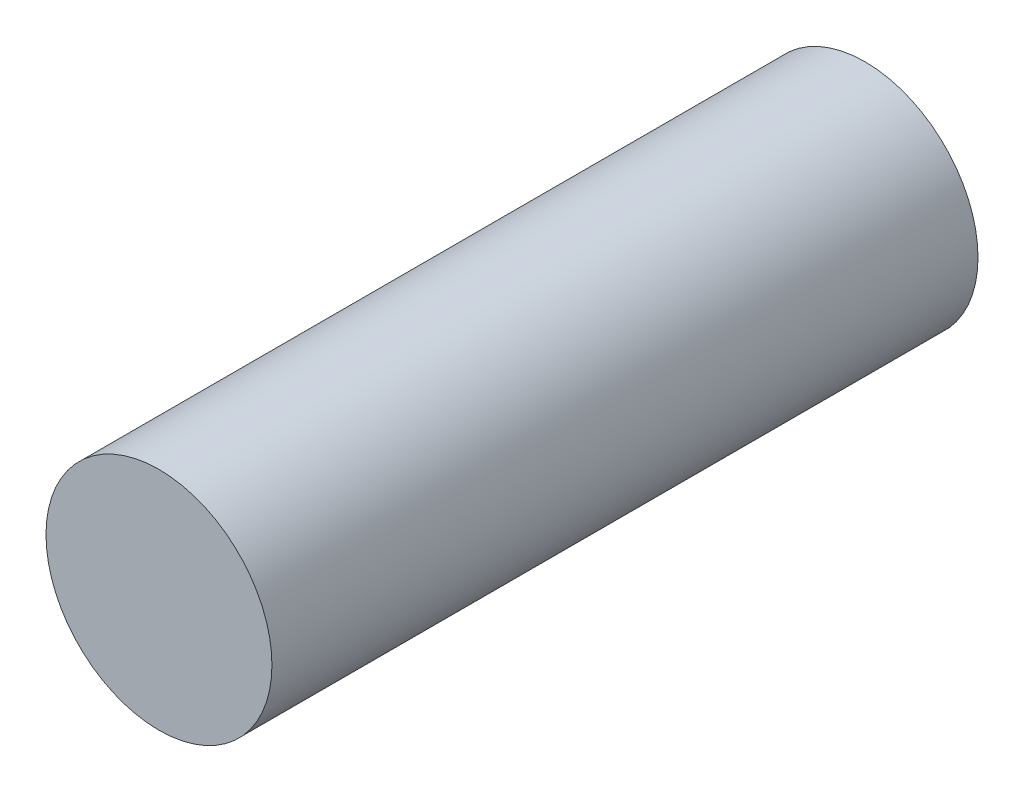
from build123d import *

# Parameters (mm, degrees)
SKETCH_1_R      = 4
EXTRUDE_1_DEPTH = 25


with BuildPart() as part:
    # 草图1 → 凸台-拉伸1 (new body)
    with BuildSketch(Plane.XY):
        Circle(SKETCH_1_R)
    extrude(amount=EXTRUDE_1_DEPTH)


solid = part.part
